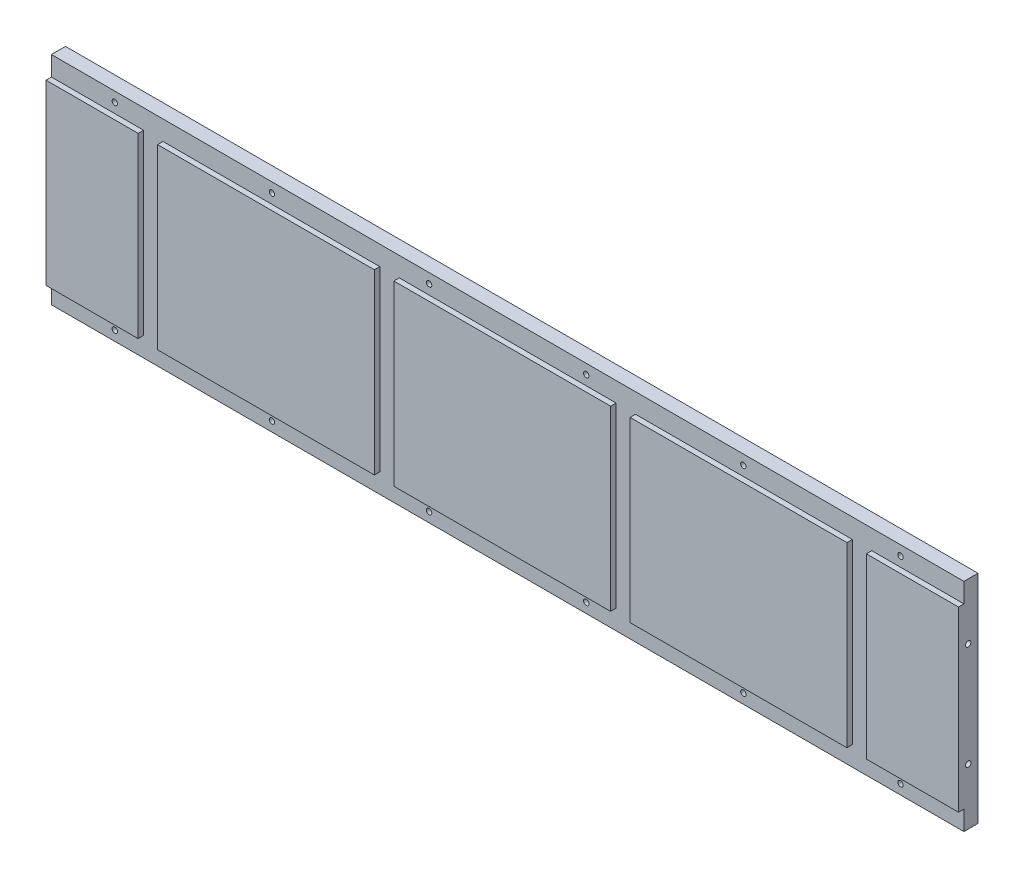
from build123d import *

# Parameters (mm, degrees)
SKETCH1_W                    = 842
SKETCH1_H                    = 200
BOSS_EXTRUDE1_DEPTH          = 18
SKETCH2_W                    = 5
SKETCH2_H                    = 18
CUT_EXTRUDE1_DEPTH           = 849.108483627
SKETCH3_W                    = 18
SKETCH3_H                    = 294.880521595
CUT_EXTRUDE2_DEPTH           = 5
F_5_0_5_DIAMETER_HOLE1_D     = 5
F_5_0_5_DIAMETER_HOLE2_D     = 5
F_5_0_5_DIAMETER_HOLE2_DEPTH = 45
F_5_0_5_DIAMETER_HOLE2_TIP   = 1.502151548
F_5_0_5_DIAMETER_HOLE3_D     = 5
F_5_0_5_DIAMETER_HOLE3_DEPTH = 45
F_5_0_5_DIAMETER_HOLE3_TIP   = 1.502151548


with BuildPart() as part:
    # Sketch1 → Boss-Extrude1 (new body)
    with BuildSketch(Plane.XY):
        Rectangle(SKETCH1_W, SKETCH1_H)
    extrude(amount=BOSS_EXTRUDE1_DEPTH)

    # Sketch2 → Cut-Extrude1 (cut, through all)
    with BuildSketch(Plane(origin=(421, 0, 0), x_dir=(0, 0, -1), z_dir=(1, 0, 0))):
        with Locations((-15.5, 91)):
            Rectangle(SKETCH2_W, SKETCH2_H)
        with Locations((-15.5, -91)):
            Rectangle(SKETCH2_W, SKETCH2_H)
    extrude(amount=-CUT_EXTRUDE1_DEPTH, mode=Mode.SUBTRACT)

    # Sketch3 → Cut-Extrude2 (cut)
    with BuildSketch(Plane.XY.offset(18)):
        with Locations((-327, -12.793720482)):
            Rectangle(SKETCH3_W, SKETCH3_H)
        with Locations((-109, -12.793720482)):
            Rectangle(SKETCH3_W, SKETCH3_H)
        with Locations((109, -12.793720482)):
            Rectangle(SKETCH3_W, SKETCH3_H)
        with Locations((327, -12.793720482)):
            Rectangle(SKETCH3_W, SKETCH3_H)
    extrude(amount=-CUT_EXTRUDE2_DEPTH, mode=Mode.SUBTRACT)

    # Ø5.0 (5) Diameter Hole1 (through all)
    with Locations(Plane.XY.offset(13)):
        with Locations((-362.5, 91), (-217.5, 91), (-72.5, 91), (72.5, 91), (217.5, 91), (362.5, 91), (-362.5, -91), (217.5, -91), (362.5, -91), (-217.5, -91), (-72.5, -91), (72.5, -91)):
            Hole(F_5_0_5_DIAMETER_HOLE1_D / 2)

    # Ø5.0 (5) Diameter Hole2
    with Locations(Plane(origin=(421, 0, 0), x_dir=(0, 0, -1), z_dir=(1, 0, 0))):
        with Locations((-9, 48), (-9, -48)):
            Hole(F_5_0_5_DIAMETER_HOLE2_D / 2, depth=F_5_0_5_DIAMETER_HOLE2_DEPTH)
            with Locations((0, 0, -(F_5_0_5_DIAMETER_HOLE2_DEPTH + F_5_0_5_DIAMETER_HOLE2_TIP / 2))):  # 118° drill point
                Cone(0, F_5_0_5_DIAMETER_HOLE2_D / 2, F_5_0_5_DIAMETER_HOLE2_TIP, mode=Mode.SUBTRACT)

    # Ø5.0 (5) Diameter Hole3
    with Locations(Plane.ZY.offset(421)):
        with Locations((9, 48), (9, -48)):
            Hole(F_5_0_5_DIAMETER_HOLE3_D / 2, depth=F_5_0_5_DIAMETER_HOLE3_DEPTH)
            with Locations((0, 0, -(F_5_0_5_DIAMETER_HOLE3_DEPTH + F_5_0_5_DIAMETER_HOLE3_TIP / 2))):  # 118° drill point
                Cone(0, F_5_0_5_DIAMETER_HOLE3_D / 2, F_5_0_5_DIAMETER_HOLE3_TIP, mode=Mode.SUBTRACT)


solid = part.part
